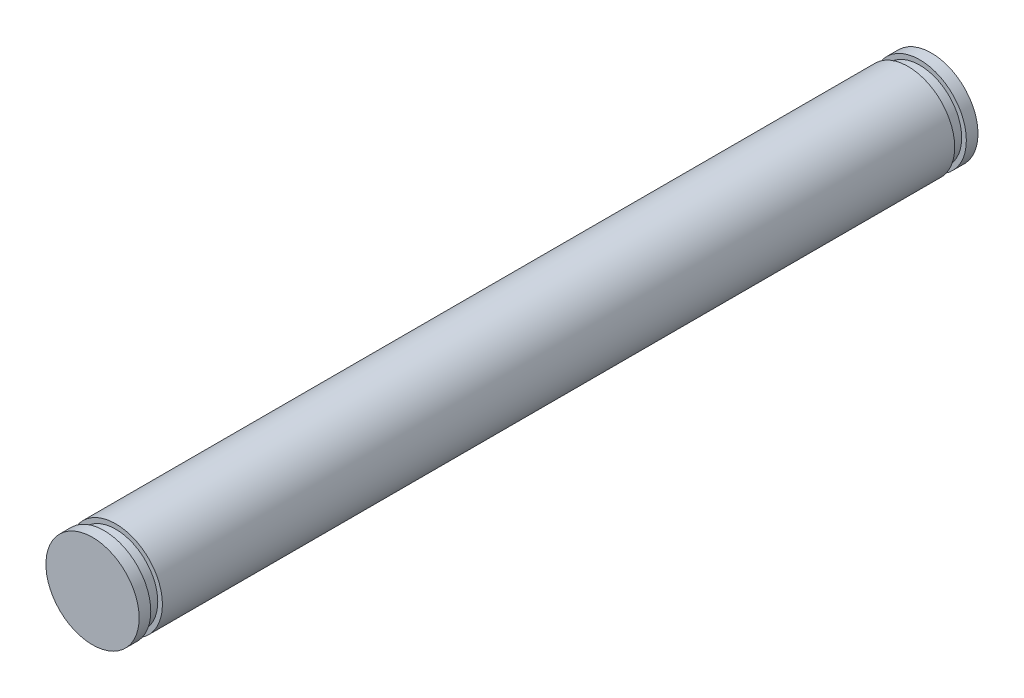
from build123d import *

# Parameters (mm, degrees)
SKETCH_1_R          = 4
EXTRUDE_1_DEPTH     = 36
CUT_EXTRUDE_START   = 1
SKETCH_2_R          = 4
SKETCH_2_R_2        = 3.6
CUT_EXTRUDE_1_DEPTH = 1


with BuildPart() as part:
    # 草图1 → 凸台-拉伸1 (new, symmetric)
    with BuildSketch(Plane.XY):
        Circle(SKETCH_1_R)
    extrude(amount=EXTRUDE_1_DEPTH, both=True)

    # 草图2 → 切除-拉伸1 (cut)
    with BuildSketch(Plane.XY.offset(34).offset(CUT_EXTRUDE_START)):
        Circle(SKETCH_2_R)
        Circle(SKETCH_2_R_2, mode=Mode.SUBTRACT)
    cut_extrude_1 = extrude(amount=-CUT_EXTRUDE_1_DEPTH, mode=Mode.SUBTRACT)

    # 镜向1: 切除-拉伸1 across plane
    add(cut_extrude_1.mirror(Plane.XY), mode=Mode.SUBTRACT)


solid = part.part
